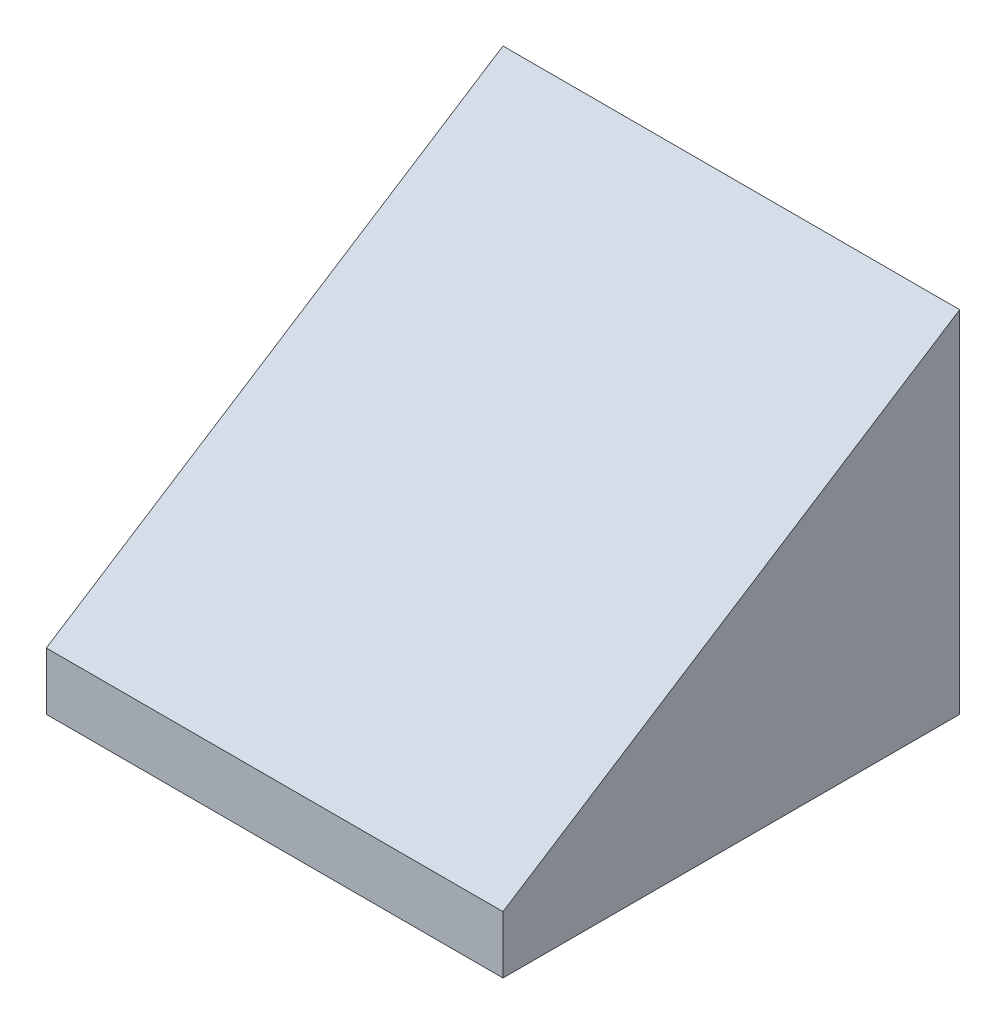
from build123d import *

# Parameters (mm, degrees)
SKETCH1_W           = 7.95
SKETCH1_H           = 6.1
BOSS_EXTRUDE1_DEPTH = 7.95
CUT_EXTRUDE1_DEPTH  = 17.7
SKETCH3_W           = 4.95
SKETCH3_H           = 4.95
CUT_EXTRUDE2_DEPTH  = 1.7


with BuildPart() as part:
    # Sketch1 → Boss-Extrude1 (new body)
    with BuildSketch(Plane(origin=(0, 0, 0), x_dir=(0, 0, -1), z_dir=(1, 0, 0))):
        with Locations((3.975, -3.05)):
            Rectangle(SKETCH1_W, SKETCH1_H)
    extrude(amount=-BOSS_EXTRUDE1_DEPTH)

    # Sketch2 → Cut-Extrude1 (cut)
    with BuildSketch(Plane(origin=(0, 0, 0), x_dir=(0, 0, -1), z_dir=(1, 0, 0))):
        Polygon((7.95, 0), (0, -5.1), (0, 0), align=None)
    extrude(amount=-CUT_EXTRUDE1_DEPTH, mode=Mode.SUBTRACT)

    # Sketch3 → Cut-Extrude2 (cut)
    with BuildSketch(Plane.XZ.offset(6.1)):
        with Locations((-3.975, -3.975)):
            Rectangle(SKETCH3_W, SKETCH3_H)
    extrude(amount=-CUT_EXTRUDE2_DEPTH, mode=Mode.SUBTRACT)


solid = part.part
